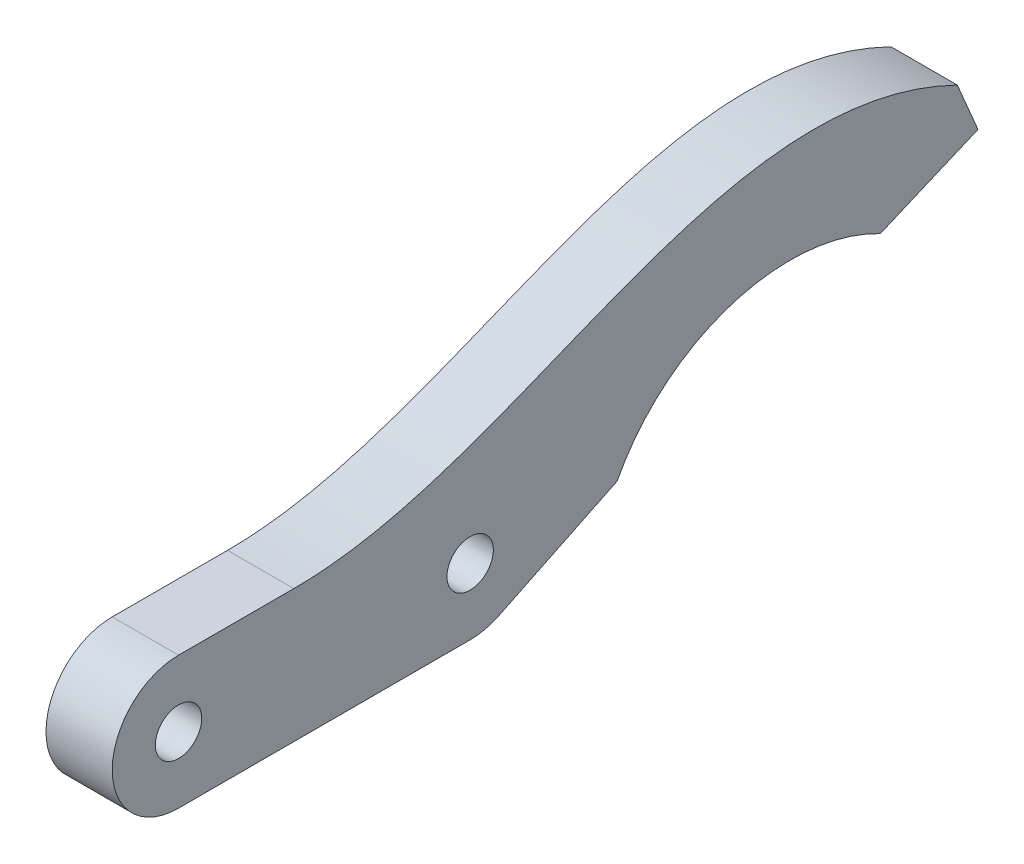
from build123d import *

# Parameters (mm, degrees)
SKETCH1_R           = 1.75
BOSS_EXTRUDE1_DEPTH = 5
BOSS_EXTRUDE2_START = -5
BOSS_EXTRUDE2_DEPTH = 5


with BuildPart() as part:
    # Sketch1 → Boss-Extrude1 (new body)
    with BuildSketch(Plane(origin=(0, 0, 0), x_dir=(0, 0, -1), z_dir=(1, 0, 0))):
        with BuildLine():
            Line((27, 10), (5, 10))
            ThreePointArc((5, 10), (0, 5), (5, 0))
            Line((5, 0), (27, 0))
            ThreePointArc((27, 0), (32, 5), (27, 10))
        make_face()
        with Locations((5, 5)):
            Circle(SKETCH1_R, mode=Mode.SUBTRACT)
        with Locations((27, 5)):
            Circle(SKETCH1_R, mode=Mode.SUBTRACT)
    extrude(amount=BOSS_EXTRUDE1_DEPTH)

    # Sketch2 → Boss-Extrude2 (add)
    with BuildSketch(Plane(origin=(5, 0, 0), x_dir=(0, 0, -1), z_dir=(1, 0, 0)).offset(BOSS_EXTRUDE2_START)):
        with BuildLine():
            add(Edge.make_bspline(
                [(63.752972286, 17.872423117), (45.928882678, 26.563787963), (31.059268621, 10), (13.694974759, 10)],
                knots=[0, 0, 0, 0, 1, 1, 1, 1], degree=3))
            Line((13.694974759, 10), (27, 10))
            ThreePointArc((27, 10), (31.87285141, 6.120410255), (29.183837075, 0.502127655))
            Line((29.183837075, 0.502127655), (38.08542066, 4.824084077))
            ThreePointArc((38.08542066, 4.824084077), (46.723585583, 12.05963883), (57.948000409, 11.067843667))
            Line((57.948000409, 11.067843667), (65.313809691, 14.189518476))
            Line((65.313809691, 14.189518476), (63.752972286, 17.872423117))
        make_face()
    extrude(amount=BOSS_EXTRUDE2_DEPTH)


solid = part.part
